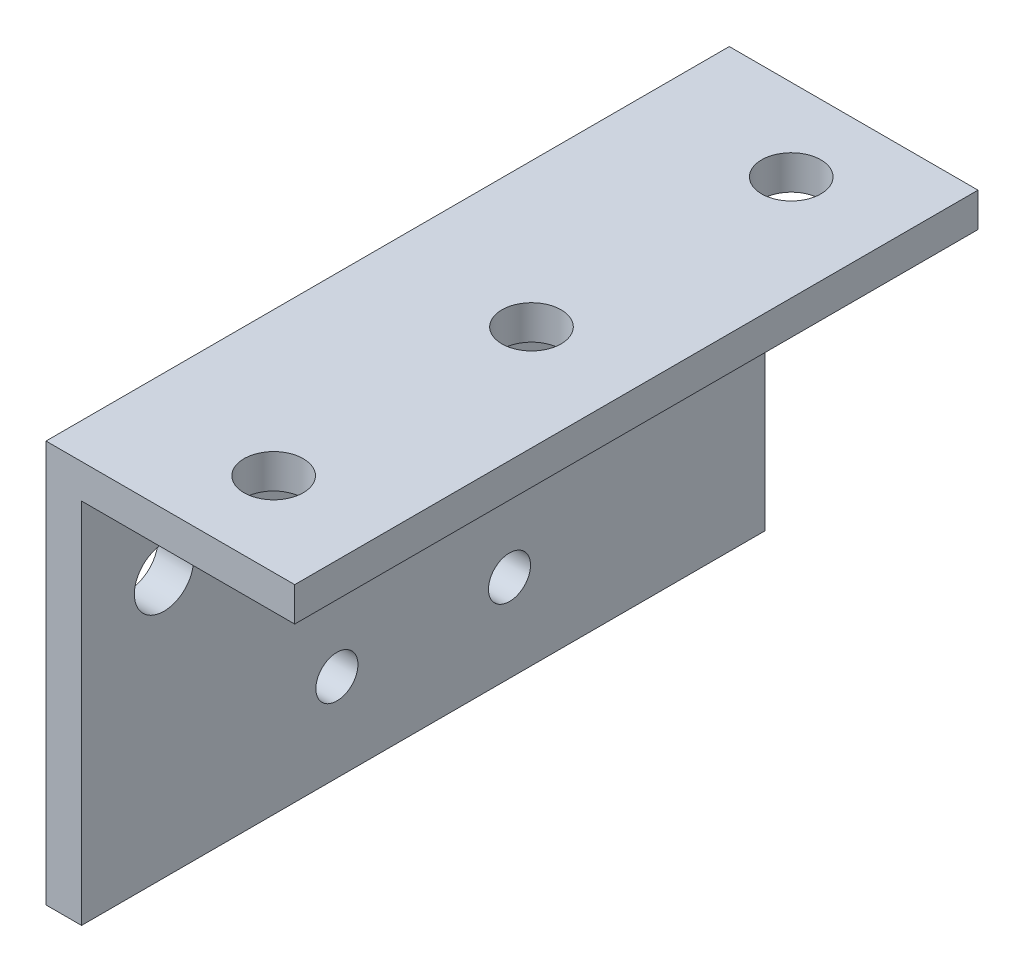
from build123d import *

# Parameters (mm, degrees)
BOSS_EXTRUDE1_DEPTH         = 63.5
M5_CLEARANCE_HOLE1_D        = 5.5
M5_CLEARANCE_HOLE2_D        = 5.5
M5_CLEARANCE_HOLE3_D        = 5.5
M5_CLEARANCE_HOLE4_D        = 5.5
F_23_0_154_DIAMETER_HOLE1_D = 3.9116
M5_CLEARANCE_HOLE5_D        = 5.5


with BuildPart() as part:
    # Sketch1 → Boss-Extrude1 (new body)
    with BuildSketch(Plane.XY):
        Polygon((0, 0), (0, 37.338), (23.114, 37.338), (23.114, 34.163), (3.302, 34.163), (3.302, 0), align=None)
    extrude(amount=BOSS_EXTRUDE1_DEPTH)

    # M5 Clearance Hole1 (through all)
    with Locations(Plane.ZY):
        with Locations((55.84134748, 24.208221519)):
            Hole(M5_CLEARANCE_HOLE1_D / 2)

    # M5 Clearance Hole2 (through all)
    with Locations(Plane.ZY):
        with Locations((7.677638483, 24.208221519)):
            Hole(M5_CLEARANCE_HOLE2_D / 2)

    # M5 Clearance Hole3 (through all)
    with Locations(Plane(origin=(0, 37.338, 0), x_dir=(1, 0, 0), z_dir=(0, 1, 0))):
        with Locations((13.368582087, -31.75)):
            Hole(M5_CLEARANCE_HOLE3_D / 2)

    # M5 Clearance Hole4 (through all)
    with Locations(Plane(origin=(0, 37.338, 0), x_dir=(1, 0, 0), z_dir=(0, 1, 0))):
        with Locations((13.368582087, -55.713693276)):
            Hole(M5_CLEARANCE_HOLE4_D / 2)

    # #23 (0.154) Diameter Hole1 (through all)
    with Locations(Plane.ZY):
        with Locations((39.767961445, 8.161533304), (23.72660366, 8.142354774), (23.72660366, 24.147573359), (39.720778954, 24.147573359)):
            Hole(F_23_0_154_DIAMETER_HOLE1_D / 2)

    # M5 Clearance Hole5 (through all)
    with Locations(Plane(origin=(0, 37.338, 0), x_dir=(1, 0, 0), z_dir=(0, 1, 0))):
        with Locations((13.368582087, -7.610649616)):
            Hole(M5_CLEARANCE_HOLE5_D / 2)


solid = part.part
